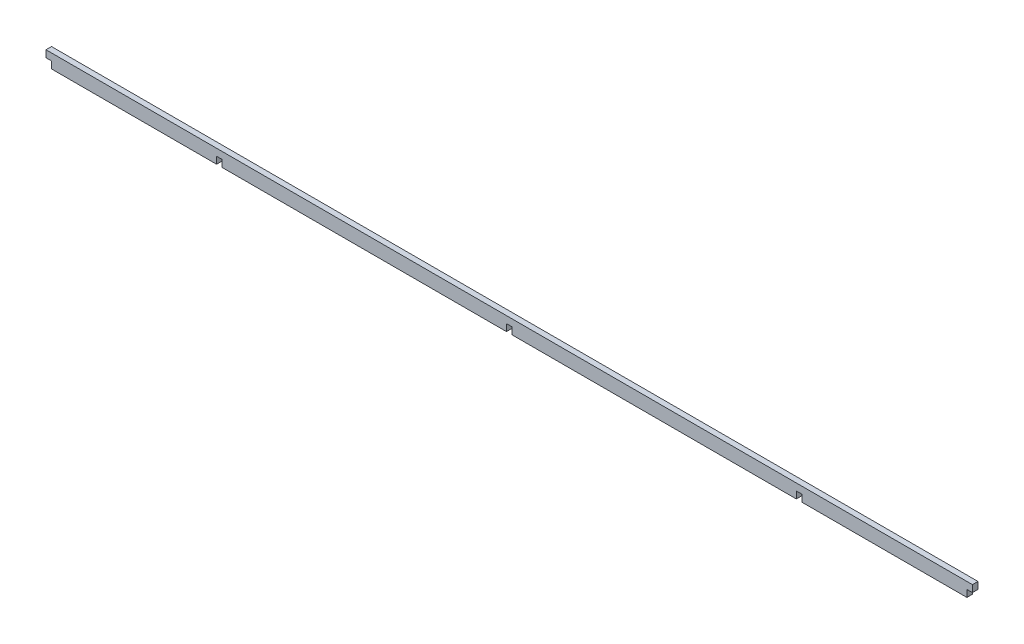
from build123d import *

# Parameters (mm, degrees)
BOSS_EXTRUDE1_DEPTH = 10


with BuildPart() as part:
    # Sketch1 → Boss-Extrude1 (new body)
    with BuildSketch(Plane.XY):
        Polygon((-5, -12.5), (-5, 0), (5, 0), (5, -12.5), (517.5, -12.5), (517.5, 0), (527.5, 0), (527.5, -12.5), (825, -12.5), (825, 0), (835, 0), (835, 12.5), (-835, 12.5), (-835, 0), (-825, 0), (-825, -12.5), (-527.5, -12.5), (-527.5, 0), (-517.5, 0), (-517.5, -12.5), align=None)
    extrude(amount=BOSS_EXTRUDE1_DEPTH)


solid = part.part
